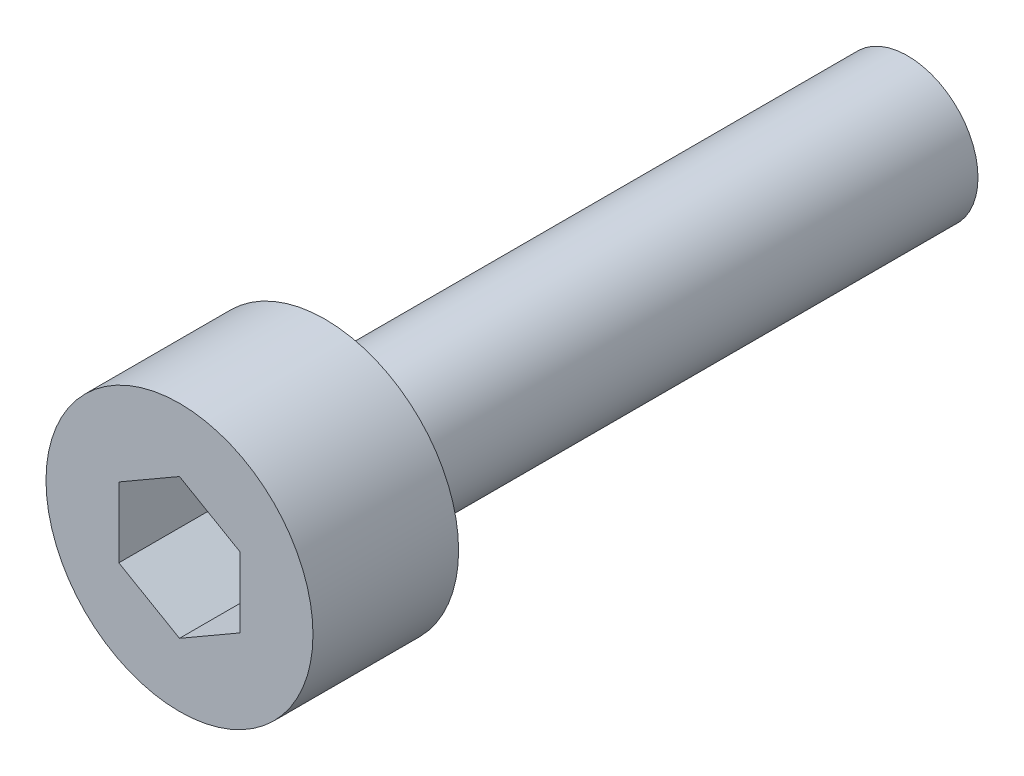
from build123d import *

# Parameters (mm, degrees)
SKETCH_1_R                     = 1.45
SHANK_THREADS_SIMPLIFIED_DEPTH = 12
SKETCH_2_R                     = 2.75
HEAD_DEPTH                     = 3
HEX_SOCKET_DEPTH               = 1.95


with BuildPart() as part:
    # 草图1 → Shank_threads_simplified (new body)
    with BuildSketch(Plane.XY):
        Circle(SKETCH_1_R)
    extrude(amount=-SHANK_THREADS_SIMPLIFIED_DEPTH)

    # 草图2 → Head (add)
    with BuildSketch(Plane.XY):
        Circle(SKETCH_2_R)
    extrude(amount=HEAD_DEPTH)

    # 草图3 → Hex_socket (cut)
    with BuildSketch(Plane.XY.offset(3)):
        Polygon((1.25, 0.721687836), (0, 1.443375673), (-1.25, 0.721687836), (-1.25, -0.721687836), (0, -1.443375673), (1.25, -0.721687836), align=None)
    extrude(amount=-HEX_SOCKET_DEPTH, mode=Mode.SUBTRACT)


solid = part.part
